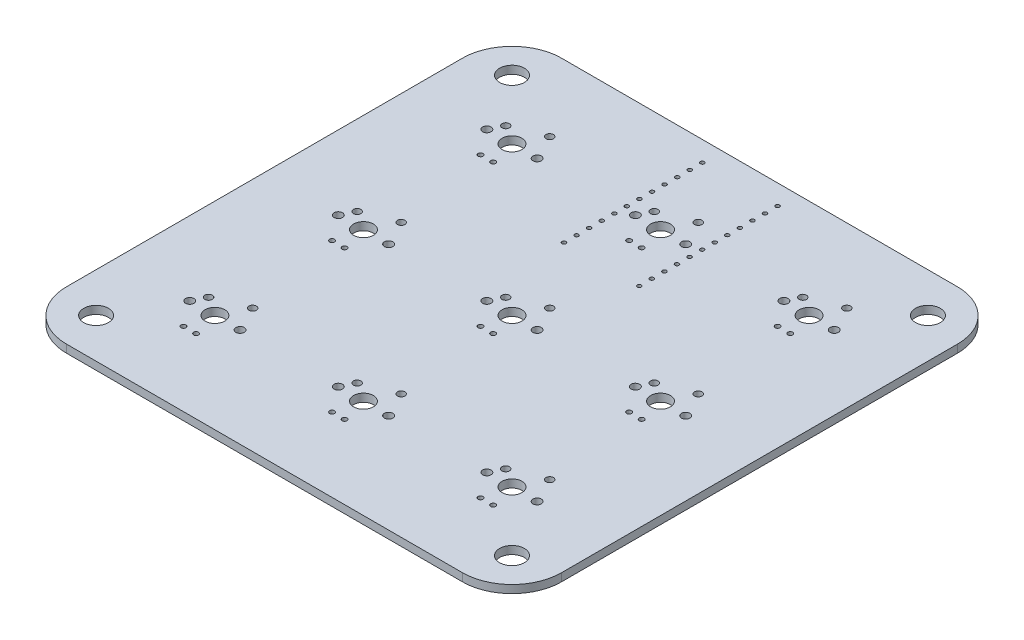
from build123d import *

# Parameters (mm, degrees)
BOSS_EXTRUDE1_DEPTH = 1.6
SKETCH2_R           = 2.5
CUT_EXTRUDE1_DEPTH  = 1.6
SKETCH3_R           = 0.4
CUT_EXTRUDE2_DEPTH  = 1.6
SKETCH4_R           = 1.9939
CUT_EXTRUDE3_DEPTH  = 1.6
SKETCH5_R           = 0.7493
SKETCH5_R_2         = 0.8509
SKETCH5_R_3         = 0.4953
CUT_EXTRUDE4_DEPTH  = 1.6


with BuildPart() as part:
    # Sketch1 → Boss-Extrude1 (new body)
    with BuildSketch(Plane(origin=(0, 0, 0), x_dir=(1, 0, 0), z_dir=(0, 1, 0))):
        with BuildLine():
            Line((40, -50), (-40, -50))
            ThreePointArc((-40, -50), (-47.071067812, -47.071067812), (-50, -40))
            Line((-50, -40), (-50, 40))
            ThreePointArc((-50, 40), (-47.071067812, 47.071067812), (-40, 50))
            Line((-40, 50), (40, 50))
            ThreePointArc((40, 50), (47.071067812, 47.071067812), (50, 40))
            Line((50, 40), (50, -40))
            ThreePointArc((50, -40), (47.071067812, -47.071067812), (40, -50))
        make_face()
    extrude(amount=BOSS_EXTRUDE1_DEPTH)

    # Sketch2 → Cut-Extrude1 (cut)
    with BuildSketch(Plane(origin=(0, 1.6, 0), x_dir=(1, 0, 0), z_dir=(0, 1, 0))):
        with Locations(Location((-42, 42, 0), (0, 0, 270))):
            Circle(SKETCH2_R)
        with Locations(Location((42, 42, 0), (0, 0, 270))):
            Circle(SKETCH2_R)
        with Locations(Location((42, -42, 0), (0, 0, 270))):
            Circle(SKETCH2_R)
        with Locations(Location((-42, -42, 0), (0, 0, 270))):
            Circle(SKETCH2_R)
    extrude(amount=-CUT_EXTRUDE1_DEPTH, mode=Mode.SUBTRACT)

    # Sketch3 → Cut-Extrude2 (cut)
    with BuildSketch(Plane(origin=(0, 1.6, 0), x_dir=(1, 0, 0), z_dir=(0, 1, 0))):
        with Locations(Location((-7.5, 18, 0), (0, 0, 270))):
            Circle(SKETCH3_R)
        with Locations(Location((7.7, 18, 0), (0, 0, 270))):
            Circle(SKETCH3_R)
        with Locations(Location((7.7, 20.54, 0), (0, 0, 270))):
            Circle(SKETCH3_R)
        with Locations(Location((7.7, 23.08, 0), (0, 0, 270))):
            Circle(SKETCH3_R)
        with Locations(Location((7.7, 25.62, 0), (0, 0, 270))):
            Circle(SKETCH3_R)
        with Locations(Location((7.7, 28.16, 0), (0, 0, 270))):
            Circle(SKETCH3_R)
        with Locations(Location((7.7, 30.7, 0), (0, 0, 270))):
            Circle(SKETCH3_R)
        with Locations(Location((7.7, 33.24, 0), (0, 0, 270))):
            Circle(SKETCH3_R)
        with Locations(Location((7.7, 35.78, 0), (0, 0, 270))):
            Circle(SKETCH3_R)
        with Locations(Location((7.7, 38.32, 0), (0, 0, 270))):
            Circle(SKETCH3_R)
        with Locations(Location((7.7, 40.86, 0), (0, 0, 270))):
            Circle(SKETCH3_R)
        with Locations(Location((7.7, 43.4, 0), (0, 0, 270))):
            Circle(SKETCH3_R)
        with Locations(Location((7.7, 45.94, 0), (0, 0, 270))):
            Circle(SKETCH3_R)
        with Locations(Location((-7.5, 20.54, 0), (0, 0, 270))):
            Circle(SKETCH3_R)
        with Locations(Location((-7.5, 23.08, 0), (0, 0, 270))):
            Circle(SKETCH3_R)
        with Locations(Location((-7.5, 25.62, 0), (0, 0, 270))):
            Circle(SKETCH3_R)
        with Locations(Location((-7.5, 28.16, 0), (0, 0, 270))):
            Circle(SKETCH3_R)
        with Locations(Location((-7.5, 30.7, 0), (0, 0, 270))):
            Circle(SKETCH3_R)
        with Locations(Location((-7.5, 33.24, 0), (0, 0, 270))):
            Circle(SKETCH3_R)
        with Locations(Location((-7.5, 35.78, 0), (0, 0, 270))):
            Circle(SKETCH3_R)
        with Locations(Location((-7.5, 38.32, 0), (0, 0, 270))):
            Circle(SKETCH3_R)
        with Locations(Location((-7.5, 40.86, 0), (0, 0, 270))):
            Circle(SKETCH3_R)
        with Locations(Location((-7.5, 43.4, 0), (0, 0, 270))):
            Circle(SKETCH3_R)
        with Locations(Location((-7.5, 45.94, 0), (0, 0, 270))):
            Circle(SKETCH3_R)
    extrude(amount=-CUT_EXTRUDE2_DEPTH, mode=Mode.SUBTRACT)

    # Sketch4 → Cut-Extrude3 (cut)
    with BuildSketch(Plane(origin=(0, 1.6, 0), x_dir=(1, 0, 0), z_dir=(0, 1, 0))):
        with Locations(Location((-30, 30, 0), (0, 0, 270))):
            Circle(SKETCH4_R)
        with Locations(Location((0, 30, 0), (0, 0, 270))):
            Circle(SKETCH4_R)
        with Locations(Location((30, 30, 0), (0, 0, 270))):
            Circle(SKETCH4_R)
        with Locations(Location((0, 0, 0), (0, 0, 270))):
            Circle(SKETCH4_R)
        with Locations(Location((30, 0, 0), (0, 0, 270))):
            Circle(SKETCH4_R)
        with Locations(Location((0, -30, 0), (0, 0, 270))):
            Circle(SKETCH4_R)
        with Locations(Location((30, -30, 0), (0, 0, 270))):
            Circle(SKETCH4_R)
        with Locations(Location((-30, 0, 0), (0, 0, 270))):
            Circle(SKETCH4_R)
        with Locations(Location((-30, -30, 0), (0, 0, 270))):
            Circle(SKETCH4_R)
    extrude(amount=-CUT_EXTRUDE3_DEPTH, mode=Mode.SUBTRACT)

    # Sketch5 → Cut-Extrude4 (cut)
    with BuildSketch(Plane(origin=(0, 1.6, 0), x_dir=(1, 0, 0), z_dir=(0, 1, 0))):
        with Locations(Location((-33.81, 32.54, 0), (0, 0, 270))):
            Circle(SKETCH5_R)
        with Locations(Location((-27.46, 35.08, 0), (0, 0, 270))):
            Circle(SKETCH5_R)
        with Locations(Location((-35.08, 30, 0), (0, 0, 270))):
            Circle(SKETCH5_R_2)
        with Locations(Location((-24.92, 30, 0), (0, 0, 270))):
            Circle(SKETCH5_R_2)
        with Locations(Location((-31.27, 24.92, 0), (0, 0, 270))):
            Circle(SKETCH5_R_3)
        with Locations(Location((-28.73, 24.92, 0), (0, 0, 270))):
            Circle(SKETCH5_R_3)
        with Locations(Location((-3.81, 32.54, 0), (0, 0, 270))):
            Circle(SKETCH5_R)
        with Locations(Location((2.54, 35.08, 0), (0, 0, 270))):
            Circle(SKETCH5_R)
        with Locations(Location((-5.08, 30, 0), (0, 0, 270))):
            Circle(SKETCH5_R_2)
        with Locations(Location((5.08, 30, 0), (0, 0, 270))):
            Circle(SKETCH5_R_2)
        with Locations(Location((-1.27, 24.92, 0), (0, 0, 270))):
            Circle(SKETCH5_R_3)
        with Locations(Location((1.27, 24.92, 0), (0, 0, 270))):
            Circle(SKETCH5_R_3)
        with Locations(Location((26.19, 32.54, 0), (0, 0, 270))):
            Circle(SKETCH5_R)
        with Locations(Location((32.54, 35.08, 0), (0, 0, 270))):
            Circle(SKETCH5_R)
        with Locations(Location((24.92, 30, 0), (0, 0, 270))):
            Circle(SKETCH5_R_2)
        with Locations(Location((35.08, 30, 0), (0, 0, 270))):
            Circle(SKETCH5_R_2)
        with Locations(Location((28.73, 24.92, 0), (0, 0, 270))):
            Circle(SKETCH5_R_3)
        with Locations(Location((31.27, 24.92, 0), (0, 0, 270))):
            Circle(SKETCH5_R_3)
        with Locations(Location((-3.81, 2.54, 0), (0, 0, 270))):
            Circle(SKETCH5_R)
        with Locations(Location((2.54, 5.08, 0), (0, 0, 270))):
            Circle(SKETCH5_R)
        with Locations(Location((-5.08, 0, 0), (0, 0, 270))):
            Circle(SKETCH5_R_2)
        with Locations(Location((5.08, 0, 0), (0, 0, 270))):
            Circle(SKETCH5_R_2)
        with Locations(Location((-1.27, -5.08, 0), (0, 0, 270))):
            Circle(SKETCH5_R_3)
        with Locations(Location((1.27, -5.08, 0), (0, 0, 270))):
            Circle(SKETCH5_R_3)
        with Locations(Location((26.19, 2.54, 0), (0, 0, 270))):
            Circle(SKETCH5_R)
        with Locations(Location((32.54, 5.08, 0), (0, 0, 270))):
            Circle(SKETCH5_R)
        with Locations(Location((24.92, 0, 0), (0, 0, 270))):
            Circle(SKETCH5_R_2)
        with Locations(Location((35.08, 0, 0), (0, 0, 270))):
            Circle(SKETCH5_R_2)
        with Locations(Location((28.73, -5.08, 0), (0, 0, 270))):
            Circle(SKETCH5_R_3)
        with Locations(Location((31.27, -5.08, 0), (0, 0, 270))):
            Circle(SKETCH5_R_3)
        with Locations(Location((-3.81, -27.46, 0), (0, 0, 270))):
            Circle(SKETCH5_R)
        with Locations(Location((2.54, -24.92, 0), (0, 0, 270))):
            Circle(SKETCH5_R)
        with Locations(Location((-5.08, -30, 0), (0, 0, 270))):
            Circle(SKETCH5_R_2)
        with Locations(Location((5.08, -30, 0), (0, 0, 270))):
            Circle(SKETCH5_R_2)
        with Locations(Location((-1.27, -35.08, 0), (0, 0, 270))):
            Circle(SKETCH5_R_3)
        with Locations(Location((1.27, -35.08, 0), (0, 0, 270))):
            Circle(SKETCH5_R_3)
        with Locations(Location((26.19, -27.46, 0), (0, 0, 270))):
            Circle(SKETCH5_R)
        with Locations(Location((32.54, -24.92, 0), (0, 0, 270))):
            Circle(SKETCH5_R)
        with Locations(Location((24.92, -30, 0), (0, 0, 270))):
            Circle(SKETCH5_R_2)
        with Locations(Location((35.08, -30, 0), (0, 0, 270))):
            Circle(SKETCH5_R_2)
        with Locations(Location((28.73, -35.08, 0), (0, 0, 270))):
            Circle(SKETCH5_R_3)
        with Locations(Location((31.27, -35.08, 0), (0, 0, 270))):
            Circle(SKETCH5_R_3)
        with Locations(Location((-33.81, 2.54, 0), (0, 0, 270))):
            Circle(SKETCH5_R)
        with Locations(Location((-27.46, 5.08, 0), (0, 0, 270))):
            Circle(SKETCH5_R)
        with Locations(Location((-35.08, 0, 0), (0, 0, 270))):
            Circle(SKETCH5_R_2)
        with Locations(Location((-24.92, 0, 0), (0, 0, 270))):
            Circle(SKETCH5_R_2)
        with Locations(Location((-31.27, -5.08, 0), (0, 0, 270))):
            Circle(SKETCH5_R_3)
        with Locations(Location((-28.73, -5.08, 0), (0, 0, 270))):
            Circle(SKETCH5_R_3)
        with Locations(Location((-33.81, -27.46, 0), (0, 0, 270))):
            Circle(SKETCH5_R)
        with Locations(Location((-27.46, -24.92, 0), (0, 0, 270))):
            Circle(SKETCH5_R)
        with Locations(Location((-35.08, -30, 0), (0, 0, 270))):
            Circle(SKETCH5_R_2)
        with Locations(Location((-24.92, -30, 0), (0, 0, 270))):
            Circle(SKETCH5_R_2)
        with Locations(Location((-31.27, -35.08, 0), (0, 0, 270))):
            Circle(SKETCH5_R_3)
        with Locations(Location((-28.73, -35.08, 0), (0, 0, 270))):
            Circle(SKETCH5_R_3)
    extrude(amount=-CUT_EXTRUDE4_DEPTH, mode=Mode.SUBTRACT)


solid = part.part
